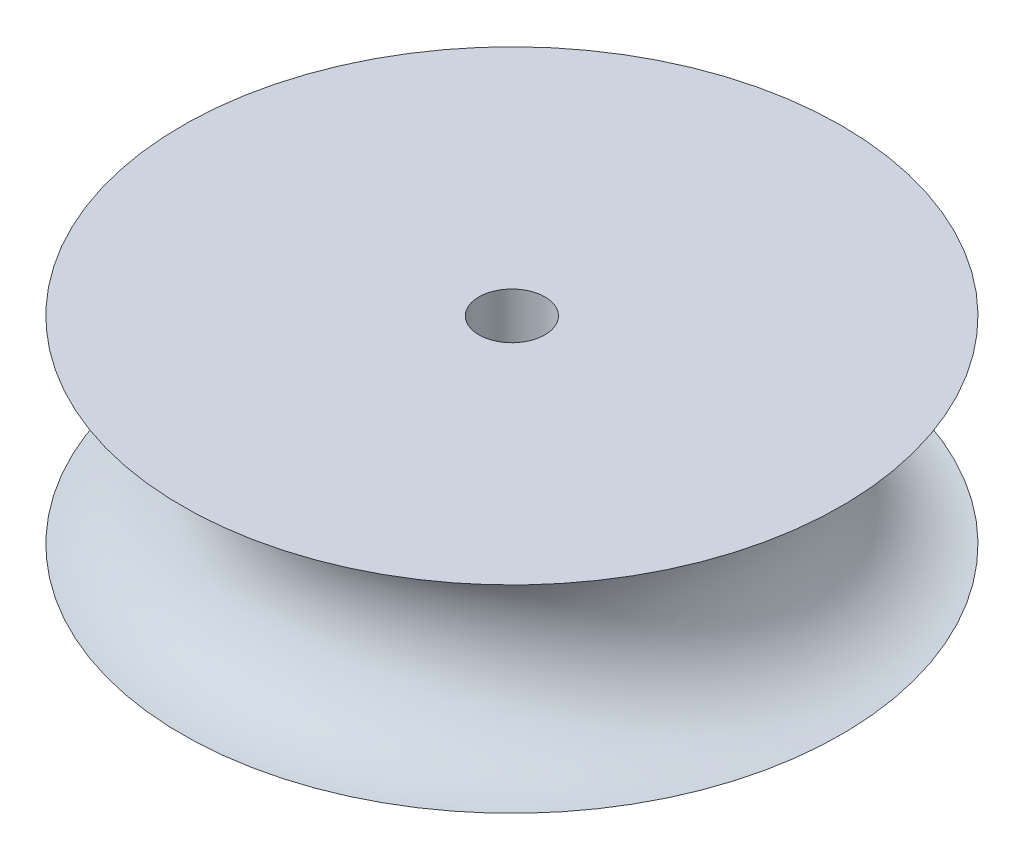
from build123d import *


with BuildPart() as part:
    # Sketch1 → Revolve1 (revolve)
    with BuildSketch(Plane.XY, mode=Mode.PRIVATE) as revolve1_sk:
        with BuildLine():
            Line((-5, 0), (-50, 0))
            ThreePointArc((-50, 0), (-35, 15), (-50, 30))
            Line((-50, 30), (-5, 30))
            Line((-5, 30), (-5, 0))
        make_face()
    revolve(revolve1_sk.sketch.rotate(Axis((0, 0, 0), (0, 1, 0)), 270), axis=Axis((0, 0, 0), (0, 1, 0)))


solid = part.part
